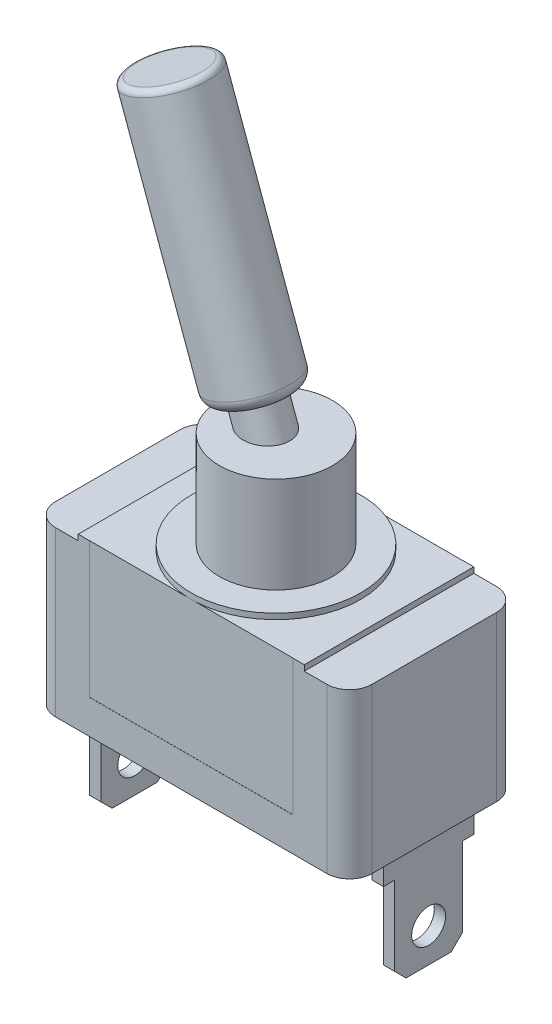
from build123d import *

# Parameters (mm, degrees)
SKETCH_1_W          = 28
SKETCH_1_H          = 15
EXTRUDE_1_DEPTH     = 15
SKETCH_2_W          = 1
SKETCH_2_H          = 8
EXTRUDE_2_DEPTH     = 2
SKETCH_3_W          = 1
SKETCH_3_H          = 6
EXTRUDE_3_DEPTH     = 8
SKETCH_4_W          = 1
SKETCH_4_H          = 6
EXTRUDE_4_DEPTH     = 8
FILLET_1_R          = 2
CHAMFER_1_SIZE      = 1
SKETCH_5_R          = 1.5
CUT_EXTRUDE_1_DEPTH = 36.881750236
SKETCH_6_W          = 4
SKETCH_6_H          = 15
CUT_EXTRUDE_2_DEPTH = 0.5
SKETCH_7_W          = 18
SKETCH_7_H          = 12
CUT_EXTRUDE_3_DEPTH = 0.01
SKETCH_8_W          = 18
SKETCH_8_H          = 12
CUT_EXTRUDE_4_DEPTH = 0.01
SKETCH_9_R          = 7.5
EXTRUDE_5_DEPTH     = 0.5
SKETCH_10_R         = 5
EXTRUDE_6_DEPTH     = 8.5
EXTRUDE_7_REACH     = 44.753
SKETCH_22_R         = 2
SKETCH_23_R         = 3.5
EXTRUDE_8_DEPTH     = 22.5
FILLET_2_R          = 1
FILLET_3_R          = 0.5


with BuildPart() as part:
    # ｽｹｯﾁ1 → ﾎﾞｽ - 押し出し1 (new body)
    with BuildSketch(Plane.XY):
        Rectangle(SKETCH_1_W, SKETCH_1_H)
    extrude(amount=EXTRUDE_1_DEPTH)

    # ｽｹｯﾁ2 → ﾎﾞｽ - 押し出し2 (add)
    with BuildSketch(Plane.XZ.offset(7.5)):
        with Locations((-13, 7.5)):
            Rectangle(SKETCH_2_W, SKETCH_2_H)
        with Locations((13, 7.5)):
            Rectangle(SKETCH_2_W, SKETCH_2_H)
    extrude(amount=EXTRUDE_2_DEPTH)

    # ｽｹｯﾁ3 → ﾎﾞｽ - 押し出し3 (add)
    with BuildSketch(Plane.XZ.offset(9.5)):
        with Locations((-13, 7.5)):
            Rectangle(SKETCH_3_W, SKETCH_3_H)
    extrude(amount=EXTRUDE_3_DEPTH)

    # ｽｹｯﾁ4 → ﾎﾞｽ - 押し出し4 (add)
    with BuildSketch(Plane.XZ.offset(9.5)):
        with Locations((13, 7.5)):
            Rectangle(SKETCH_4_W, SKETCH_4_H)
    extrude(amount=EXTRUDE_4_DEPTH)

    # ﾌｨﾚｯﾄ1
    fillet_1_edges = [part.edges().sort_by_distance(p)[0] for p in [
        (14, 0, 15),
        (-14, 0, 15),
        (14, 0, 0),
        (-14, 0, 0),
    ]]
    fillet(fillet_1_edges, radius=FILLET_1_R)

    # 面取り1
    chamfer_1_edges = [part.edges().sort_by_distance(p)[0] for p in [
        (-13, -17.5, 4.5),
        (-13, -17.5, 10.5),
        (13, -17.5, 4.5),
        (13, -17.5, 10.5),
    ]]
    chamfer(chamfer_1_edges, length=CHAMFER_1_SIZE)

    # ｽｹｯﾁ5 → ｶｯﾄ - 押し出し1 (cut, through all)
    with BuildSketch(Plane(origin=(13.5, 0, 0), x_dir=(0, 0, -1), z_dir=(1, 0, 0))):
        with Locations((-7.5, -14.5)):
            Circle(SKETCH_5_R)
    extrude(amount=-CUT_EXTRUDE_1_DEPTH, mode=Mode.SUBTRACT)

    # ｽｹｯﾁ6 → ｶｯﾄ - 押し出し2 (cut)
    with BuildSketch(Plane(origin=(0, 7.5, 0), x_dir=(1, 0, 0), z_dir=(0, 1, 0))):
        with Locations((-12, -7.5)):
            Rectangle(SKETCH_6_W, SKETCH_6_H)
        with Locations((12, -7.5)):
            Rectangle(SKETCH_6_W, SKETCH_6_H)
    extrude(amount=-CUT_EXTRUDE_2_DEPTH, mode=Mode.SUBTRACT)

    # ｽｹｯﾁ7 → ｶｯﾄ - 押し出し3 (cut)
    with BuildSketch(Plane.XY.offset(15)):
        with Locations((0, 1.5)):
            Rectangle(SKETCH_7_W, SKETCH_7_H)
    extrude(amount=-CUT_EXTRUDE_3_DEPTH, mode=Mode.SUBTRACT)

    # ｽｹｯﾁ8 → ｶｯﾄ - 押し出し4 (cut)
    with BuildSketch(Plane(origin=(0, 0, 0), x_dir=(-1, 0, 0), z_dir=(0, 0, -1))):
        with Locations((0, 1.5)):
            Rectangle(SKETCH_8_W, SKETCH_8_H)
    extrude(amount=-CUT_EXTRUDE_4_DEPTH, mode=Mode.SUBTRACT)

    # ｽｹｯﾁ9 → ﾎﾞｽ - 押し出し5 (add)
    with BuildSketch(Plane(origin=(0, 7.5, 0), x_dir=(1, 0, 0), z_dir=(0, 1, 0))):
        with Locations(Location((0, -7.5, 0), (0, 0, 272.959070179))):
            Circle(SKETCH_9_R)
    extrude(amount=EXTRUDE_5_DEPTH)

    # ｽｹｯﾁ10 → ﾎﾞｽ - 押し出し6 (add)
    with BuildSketch(Plane(origin=(0, 8, 0), x_dir=(1, 0, 0), z_dir=(0, 1, 0))):
        with Locations(Location((0, -7.5, 0), (0, 0, 180))):
            Circle(SKETCH_10_R)
    extrude(amount=EXTRUDE_6_DEPTH)


with BuildPart() as body_2:
    # ﾎﾞｽ - 押し出し7: up to this plane
    extrude_7_end = Plane(origin=(0, 16.5, 7.5), z_dir=(0, 1, 0))
    # ｽｹｯﾁ22 → ﾎﾞｽ - 押し出し7 (new, up to the surface)
    with BuildSketch(Plane(origin=(-6.209280477, 17.059857902, 0), x_dir=(-0.9396926207859082, -0.3420201433256695, 0), z_dir=(0.3420201433256695, -0.9396926207859082, 0)), mode=Mode.PRIVATE) as extrude_7_sk1:
        with Locations((-4.786889404, -7.5)):
            Circle(SKETCH_22_R)
    extrude_7_tool1 = split(extrude(extrude_7_sk1.sketch, amount=EXTRUDE_7_REACH, mode=Mode.PRIVATE), bisect_by=extrude_7_end, keep=Keep.BOTH, mode=Mode.PRIVATE)
    add(extrude_7_tool1.solids().sort_by_distance((-1.711076, 18.697071, 7.5))[0])

    # ｽｹｯﾁ23 → ﾎﾞｽ - 押し出し8 (add)
    with BuildSketch(Plane(origin=(-6.209280477, 17.059857902, 0), x_dir=(-0.9396926207859082, -0.3420201433256695, 0), z_dir=(0.3420201433256695, -0.9396926207859082, 0))):
        with Locations(Location((-4.786889404, -7.5, 0), (0, 0, 180))):
            Circle(SKETCH_23_R)
    extrude(amount=-EXTRUDE_8_DEPTH)

    # ﾌｨﾚｯﾄ2
    fillet_2_edges = [body_2.edges().sort_by_distance(p)[0] for p in [
        (-5, 17.5, 7.5),
    ]]
    fillet(fillet_2_edges, radius=FILLET_2_R)

    # ﾌｨﾚｯﾄ3
    fillet_3_edges = [body_2.edges().sort_by_distance(p)[0] for p in [
        (-12.695453225, 38.643083968, 7.5),
    ]]
    fillet(fillet_3_edges, radius=FILLET_3_R)


solid = Compound([part.part, body_2.part])
